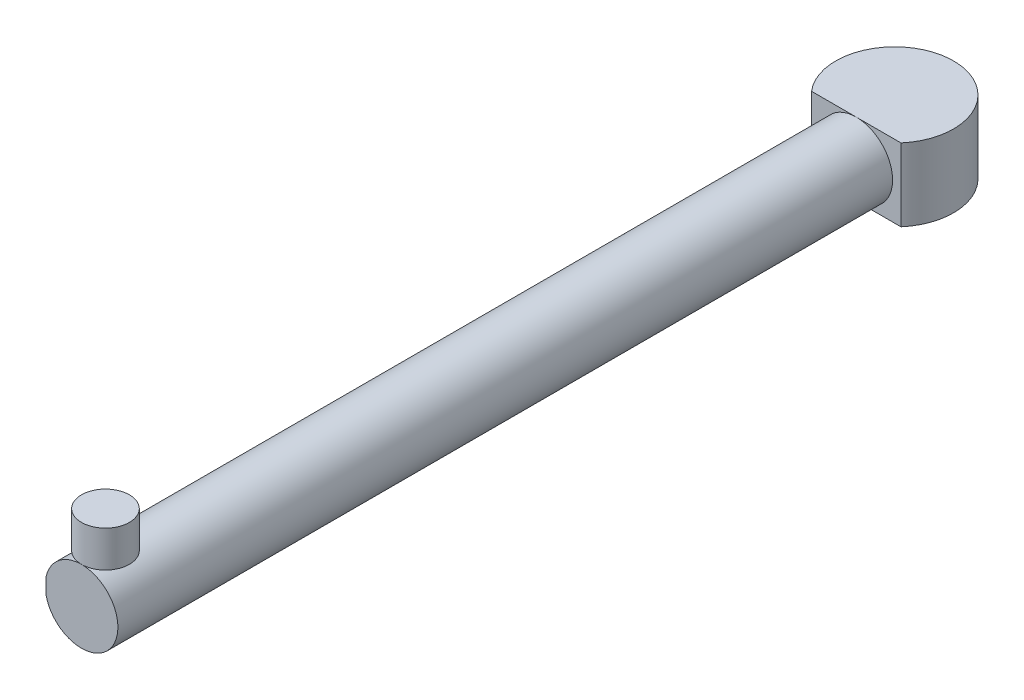
from build123d import *
from build123d.topology import SkipClean

# Parameters (mm, degrees)
BOSS_EXTRUDE1_DEPTH = 20
CUT_EXTRUDE3_DEPTH  = 200
SKETCH5_W           = 19.772216907
SKETCH5_H           = 13.173491176
BOSS_EXTRUDE2_DEPTH = 30
CUT_EXTRUDE6_DEPTH  = 10
CUT_EXTRUDE8_START  = -34
CUT_EXTRUDE8_DEPTH  = 34


with BuildPart() as part:
    # Sketch1 → Boss-Extrude1 (new body)
    with BuildSketch(Plane(origin=(0, 0, 0), x_dir=(1, 0, 0), z_dir=(0, 1, 0))):
        with BuildLine():
            Line((12.303213462, -75.831786225), (-12.303213462, -75.831786225))
            Line((-12.303213462, -75.831786225), (-12.303213462, 124.168213775))
            ThreePointArc((-12.303213462, 124.168213775), (0, 150.953919879), (12.303213462, 124.168213775))
            Line((12.303213462, 124.168213775), (12.303213462, -75.831786225))
        make_face()
    extrude(amount=BOSS_EXTRUDE1_DEPTH)

    # Sketch3 → Cut-Extrude3 (cut)
    with BuildSketch(Plane.XY.offset(75.831786225)):
        with BuildLine():
            Line((5e-09, 0), (12.303213462, 0))
            Line((12.303213462, 0), (12.303213462, 20))
            Line((12.303213462, 20), (5.3e-08, 20))
            ThreePointArc((5.3e-08, 20), (10, 9.999999976), (5e-09, 0))
        make_face()
        with BuildLine():
            Line((-12.303213462, 0), (5e-09, 0))
            ThreePointArc((5e-09, 0), (-10, 10.000000024), (5.3e-08, 20))
            Line((5.3e-08, 20), (-12.303213462, 20))
            Line((-12.303213462, 20), (-12.303213462, 0))
        make_face()
    extrude(amount=-CUT_EXTRUDE3_DEPTH, mode=Mode.SUBTRACT)

    # Sketch5 → Boss-Extrude2 (add)
    with BuildSketch(Plane(origin=(0, 0, 0), x_dir=(1, 0, 0), z_dir=(0, 1, 0))):
        with Locations((0.113891546, -82.418531813)):
            Rectangle(SKETCH5_W, SKETCH5_H)
    extrude(amount=BOSS_EXTRUDE2_DEPTH)

    # Sketch6 → Cut-Extrude6 (cut)
    with BuildSketch(Plane(origin=(0, 30, 0), x_dir=(1, 0, 0), z_dir=(0, 1, 0))):
        with BuildLine():
            ThreePointArc((0, -89.005277401), (-6.586745588, -82.418531813), (0, -75.831786225))
            Line((0, -75.831786225), (-9.772216907, -75.831786225))
            Line((-9.772216907, -75.831786225), (-9.772216907, -89.005277401))
            Line((-9.772216907, -89.005277401), (0, -89.005277401))
        make_face()
        with BuildLine():
            Line((10, -75.831786225), (0, -75.831786225))
            ThreePointArc((0, -75.831786225), (6.586745588, -82.418531813), (0, -89.005277401))
            Line((0, -89.005277401), (10, -89.005277401))
            Line((10, -89.005277401), (10, -75.831786225))
        make_face()
    extrude(amount=-CUT_EXTRUDE6_DEPTH, mode=Mode.SUBTRACT)

    # Sketch9 → Cut-Extrude8 (cut)
    with SkipClean():  # the faces are left unmerged after this step: merging them gives an invalid solid
        with BuildSketch(Plane(origin=(0, 0, 75.831786225), x_dir=(-1, 0, 0), z_dir=(0, 0, -1)).offset(CUT_EXTRUDE8_START)):
            with BuildLine():
                Line((9.772216907, 12.12221034), (9.772216907, 20))
                Line((9.772216907, 20), (0, 20))
                ThreePointArc((0, 20), (6.276061528, 17.785309994), (9.772216907, 12.12221034))
            make_face()
            with BuildLine():
                ThreePointArc((9.772216907, 7.87778966), (6.276061528, 2.214690006), (0, 0))
                Line((0, 0), (9.772216907, 0))
                Line((9.772216907, 0), (9.772216907, 7.87778966))
            make_face()
            with BuildLine():
                ThreePointArc((0, 0), (-7.071067812, 2.928932188), (-10, 10))
                Line((-10, 10), (-10, 0))
                Line((-10, 0), (0, 0))
            make_face()
            with BuildLine():
                ThreePointArc((-10, 10), (-7.071067812, 17.071067812), (0, 20))
                Line((0, 20), (-10, 20))
                Line((-10, 20), (-10, 10))
            make_face()
        extrude(amount=CUT_EXTRUDE8_DEPTH, mode=Mode.SUBTRACT)


with BuildPart() as cut_extrude8_piece_1:
    # of the separate pieces the step leaves, piece 1, a body of its own (cut_extrude8_pieces)
    add(part.part.solids().sort_by_distance((-12.303213462, 0, -124.168213775))[0])


with BuildPart() as cut_extrude8_piece_2:
    # of the separate pieces the step leaves, piece 2, a body of its own (cut_extrude8_pieces)
    add(part.part.solids().sort_by_distance((0, 30, 89.005277401))[0])


solid = Compound([cut_extrude8_piece_1.part, cut_extrude8_piece_2.part])
